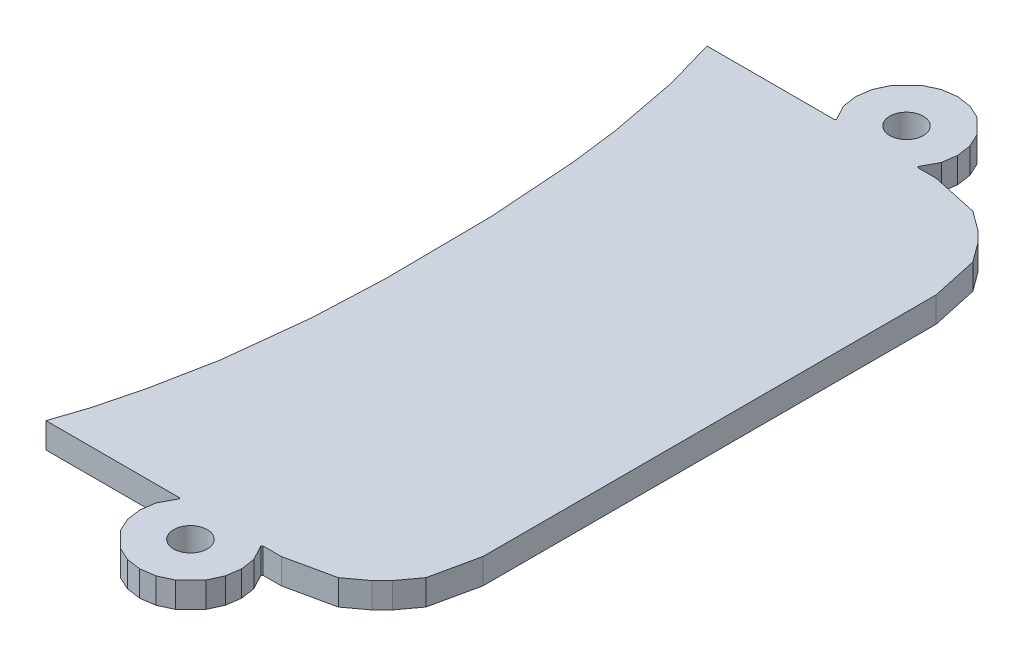
from build123d import *

# Parameters (mm, degrees)
PEDAL_COVER_DEPTH       = 2.5
SKETCH2_R               = 1.65
COVER_SCREW_HOLES_DEPTH = 112.685719768


with BuildPart() as part:
    # Sketch1 → Pedal cover (new body)
    with BuildSketch(Plane(origin=(0, 28, 0), x_dir=(1, 0, 0), z_dir=(0, 1, 0))):
        Polygon((86.3, 45.2), (84.9, 45), (83.6, 44.4), (82.1, 42.9), (81.5, 41.6), (81.3, 40.2), (81.5, 38.8), (82.3, 37.3), (82.2, 37.2), (69.7, 37.2), (71.1, 32.3), (72.4, 25.5), (73, 20.7), (73.6, 12.1), (73.7, 1.7), (73.4, -5.3), (72.5, -13.4), (71.3, -19.5), (70.2, -23.8), (69.1, -27.1), (82.2, -27.1), (82.3, -27.2), (81.5, -28.7), (81.3, -30.1), (81.5, -31.5), (82.1, -32.8), (83.6, -34.3), (84.9, -34.9), (86.3, -35.1), (87.7, -34.9), (89, -34.3), (90.5, -32.8), (91.1, -31.5), (91.3, -30.1), (91.1, -28.7), (90.3, -27.2), (90.4, -27.1), (92.2, -27.1), (96.8, -26.1), (98.7, -24.7), (99.7, -23.7), (101.1, -21.8), (102.1, -17.2), (102.1, 27.3), (101.1, 31.9), (99.7, 33.8), (98.7, 34.8), (96.8, 36.2), (92.2, 37.2), (90.4, 37.2), (90.3, 37.3), (91.1, 38.8), (91.3, 40.2), (91.1, 41.6), (90.5, 42.9), (89, 44.4), (87.7, 45), align=None)
    extrude(amount=PEDAL_COVER_DEPTH)

    # Sketch2 → Cover screw holes (cut, through all)
    with BuildSketch(Plane(origin=(0, 28, 0), x_dir=(1, 0, 0), z_dir=(0, 1, 0))):
        with Locations(Location((86.28, 40.2, 0), (0, 0, 270))):
            Circle(SKETCH2_R)
        with Locations(Location((86.28, -30.1, 0), (0, 0, 270))):
            Circle(SKETCH2_R)
    extrude(amount=COVER_SCREW_HOLES_DEPTH, mode=Mode.SUBTRACT)


solid = part.part
